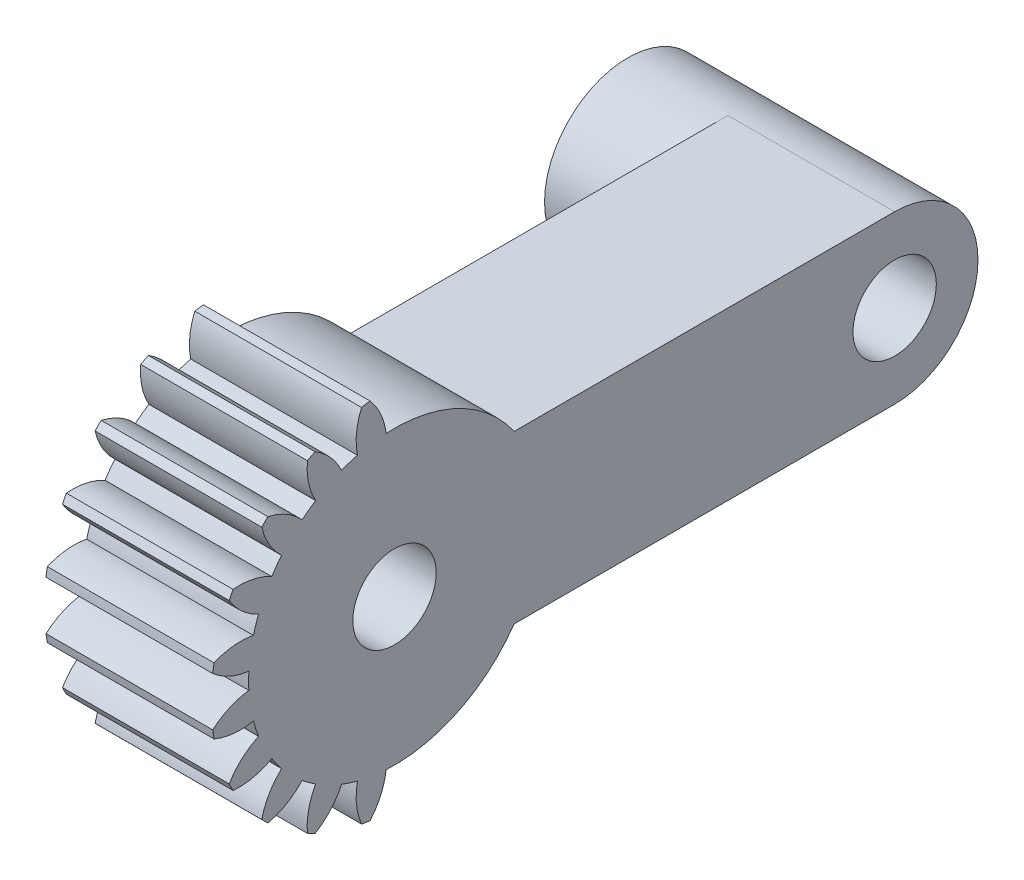
from build123d import *

# Parameters (mm, degrees)
SKETCH1_R           = 2.5
BOSS_EXTRUDE1_DEPTH = 10
SKETCH2_R           = 2.5
BOSS_EXTRUDE2_DEPTH = 10
SKETCH3_R           = 5
SKETCH3_R_2         = 2.5
BOSS_EXTRUDE3_DEPTH = 6
SKETCH4_R           = 2.5
CUT_EXTRUDE1_DEPTH  = 5
SKETCH6_R           = 1.5
CUT_EXTRUDE2_DEPTH  = 40.400672482
CUT_EXTRUDE3_START  = -3
SKETCH7_R           = 2.5
CUT_EXTRUDE3_DEPTH  = 3
SKETCH8_R           = 4.5
SKETCH8_R_2         = 2.5
BOSS_EXTRUDE4_DEPTH = 2
CUT_EXTRUDE4_DEPTH  = 42.078132772


with BuildPart() as part:
    # Sketch1 → Boss-Extrude1 (new body)
    with BuildSketch(Plane(origin=(4.043870029, 0, 0), x_dir=(0, 0, -1), z_dir=(1, 0, 0))):
        with BuildLine():
            ThreePointArc((-10.029541992, 0.342879069), (-9.019080639, -0.304016541), (-7.862233613, -0.622153359))
            ThreePointArc((-7.862233613, -0.622153359), (-7.876528296, -1.122077366), (-7.862233613, -1.622001374))
            ThreePointArc((-7.862233613, -1.622001374), (-9.019080639, -1.940138191), (-10.029541992, -2.587033801))
            ThreePointArc((-10.029541992, -2.587033801), (-9.992100042, -2.842856482), (-9.948655897, -3.097728508))
            ThreePointArc((-9.948655897, -3.097728508), (-8.787748306, -3.400713063), (-7.58921172, -3.345793765))
            ThreePointArc((-7.58921172, -3.345793765), (-7.448321757, -3.82566705), (-7.280241692, -4.296705735))
            ThreePointArc((-7.280241692, -4.296705735), (-8.282158911, -4.956757219), (-9.043263028, -5.884241235))
            ThreePointArc((-9.043263028, -5.884241235), (-8.928600062, -6.115972863), (-8.808522437, -6.344945585))
            ThreePointArc((-8.808522437, -6.344945585), (-7.610806331, -6.274360846), (-6.487901298, -5.851761317))
            ThreePointArc((-6.487901298, -5.851761317), (-6.20561798, -6.264610538), (-5.90020538, -6.660655353))
            ThreePointArc((-5.90020538, -6.660655353), (-6.649118154, -7.598011066), (-7.086362862, -8.715294889))
            ThreePointArc((-7.086362862, -8.715294889), (-6.905702889, -8.900251959), (-6.720745819, -9.080911932))
            ThreePointArc((-6.720745819, -9.080911932), (-5.603461996, -8.643667224), (-4.666106283, -7.89475445))
            ThreePointArc((-4.666106283, -7.89475445), (-4.270061468, -8.20016705), (-3.857212247, -8.482450368))
            ThreePointArc((-3.857212247, -8.482450368), (-4.279811776, -9.605355401), (-4.350396515, -10.803071507))
            ThreePointArc((-4.350396515, -10.803071507), (-4.121423793, -10.923149132), (-3.889692165, -11.037812099))
            ThreePointArc((-3.889692165, -11.037812099), (-2.962208149, -10.276707981), (-2.302156665, -9.274790762))
            ThreePointArc((-2.302156665, -9.274790762), (-1.83111798, -9.442870827), (-1.351244695, -9.583760791))
            ThreePointArc((-1.351244695, -9.583760791), (-1.406163992, -10.782297376), (-1.103179437, -11.943204968))
            ThreePointArc((-1.103179437, -11.943204968), (-0.848307411, -11.986649113), (-0.592484731, -12.024091063))
            ThreePointArc((-0.592484731, -12.024091063), (0.054410879, -11.01362971), (0.372547697, -9.856782684))
            ThreePointArc((0.372547697, -9.856782684), (0.872471704, -9.871077366), (1.372395712, -9.856782684))
            ThreePointArc((1.372395712, -9.856782684), (1.690532529, -11.01362971), (2.337428139, -12.024091063))
            ThreePointArc((2.337428139, -12.024091063), (2.59325082, -11.986649113), (2.848122846, -11.943204968))
            ThreePointArc((2.848122846, -11.943204968), (3.151107401, -10.782297376), (3.096188103, -9.583760791))
            ThreePointArc((3.096188103, -9.583760791), (3.576061388, -9.442870827), (4.047100073, -9.274790762))
            ThreePointArc((4.047100073, -9.274790762), (4.707151558, -10.276707981), (5.634635573, -11.037812099))
            ThreePointArc((5.634635573, -11.037812099), (5.866367201, -10.923149132), (6.095339923, -10.803071507))
            ThreePointArc((6.095339923, -10.803071507), (6.024755184, -9.605355401), (5.602155655, -8.482450368))
            ThreePointArc((5.602155655, -8.482450368), (6.015004877, -8.20016705), (6.411049691, -7.89475445))
            ThreePointArc((6.411049691, -7.89475445), (7.348405404, -8.643667224), (8.465689227, -9.080911932))
            ThreePointArc((8.465689227, -9.080911932), (8.650646297, -8.900251959), (8.83130627, -8.715294889))
            ThreePointArc((8.83130627, -8.715294889), (8.394061563, -7.598011066), (7.645148788, -6.660655353))
            ThreePointArc((7.645148788, -6.660655353), (7.950561388, -6.264610538), (8.232844706, -5.851761317))
            ThreePointArc((8.232844706, -5.851761317), (9.355749739, -6.274360846), (10.553465846, -6.344945585))
            ThreePointArc((10.553465846, -6.344945585), (10.67354347, -6.115972863), (10.788206437, -5.884241235))
            ThreePointArc((10.788206437, -5.884241235), (10.02710232, -4.956757219), (9.0251851, -4.296705735))
            ThreePointArc((9.0251851, -4.296705735), (9.193265165, -3.82566705), (9.334155129, -3.345793765))
            ThreePointArc((9.334155129, -3.345793765), (10.532691714, -3.400713063), (11.693599306, -3.097728508))
            ThreePointArc((11.693599306, -3.097728508), (11.737043451, -2.842856482), (11.774485401, -2.587033801))
            ThreePointArc((11.774485401, -2.587033801), (10.764024048, -1.940138191), (9.607177022, -1.622001374))
            ThreePointArc((9.607177022, -1.622001374), (9.621471704, -1.122077366), (9.607177022, -0.622153359))
            ThreePointArc((9.607177022, -0.622153359), (10.764024048, -0.304016541), (11.774485401, 0.342879069))
            ThreePointArc((11.774485401, 0.342879069), (11.737043451, 0.598701749), (11.693599306, 0.853573775))
            ThreePointArc((11.693599306, 0.853573775), (10.532691714, 1.156558331), (9.334155129, 1.101639033))
            ThreePointArc((9.334155129, 1.101639033), (9.193265165, 1.581512318), (9.0251851, 2.052551003))
            ThreePointArc((9.0251851, 2.052551003), (10.02710232, 2.712602487), (10.788206437, 3.640086503))
            ThreePointArc((10.788206437, 3.640086503), (10.67354347, 3.871818131), (10.553465846, 4.100790853))
            ThreePointArc((10.553465846, 4.100790853), (9.355749739, 4.030206114), (8.232844706, 3.607606585))
            ThreePointArc((8.232844706, 3.607606585), (7.950561388, 4.020455806), (7.645148788, 4.416500621))
            ThreePointArc((7.645148788, 4.416500621), (8.394061563, 5.353856334), (8.83130627, 6.471140157))
            ThreePointArc((8.83130627, 6.471140157), (8.650646297, 6.656097227), (8.465689227, 6.8367572))
            ThreePointArc((8.465689227, 6.8367572), (7.348405404, 6.399512492), (6.411049691, 5.650599718))
            ThreePointArc((6.411049691, 5.650599718), (6.015004877, 5.956012318), (5.602155655, 6.238295636))
            ThreePointArc((5.602155655, 6.238295636), (6.024755184, 7.361200669), (6.095339923, 8.558916775))
            ThreePointArc((6.095339923, 8.558916775), (5.866367201, 8.6789944), (5.634635573, 8.793657366))
            ThreePointArc((5.634635573, 8.793657366), (4.707151558, 8.032553249), (4.047100073, 7.03063603))
            ThreePointArc((4.047100073, 7.03063603), (3.576061388, 7.198716095), (3.096188103, 7.339606058))
            ThreePointArc((3.096188103, 7.339606058), (3.151107401, 8.538142644), (2.848122846, 9.699050235))
            ThreePointArc((2.848122846, 9.699050235), (2.59325082, 9.74249438), (2.337428139, 9.779936331))
            ThreePointArc((2.337428139, 9.779936331), (1.690532529, 8.769474978), (1.372395712, 7.612627952))
            ThreePointArc((1.372395712, 7.612627952), (0.872471704, 7.626922634), (0.372547697, 7.612627952))
            ThreePointArc((0.372547697, 7.612627952), (0.054410879, 8.769474978), (-0.592484731, 9.779936331))
            ThreePointArc((-0.592484731, 9.779936331), (-0.848307411, 9.74249438), (-1.103179437, 9.699050235))
            ThreePointArc((-1.103179437, 9.699050235), (-1.406163992, 8.538142644), (-1.351244695, 7.339606058))
            ThreePointArc((-1.351244695, 7.339606058), (-1.83111798, 7.198716095), (-2.302156665, 7.03063603))
            ThreePointArc((-2.302156665, 7.03063603), (-2.962208149, 8.032553249), (-3.889692165, 8.793657366))
            ThreePointArc((-3.889692165, 8.793657366), (-4.121423793, 8.6789944), (-4.350396515, 8.558916775))
            ThreePointArc((-4.350396515, 8.558916775), (-4.279811776, 7.361200669), (-3.857212247, 6.238295636))
            ThreePointArc((-3.857212247, 6.238295636), (-4.270061468, 5.956012318), (-4.666106283, 5.650599718))
            ThreePointArc((-4.666106283, 5.650599718), (-5.603461996, 6.399512492), (-6.720745819, 6.8367572))
            ThreePointArc((-6.720745819, 6.8367572), (-6.905702889, 6.656097227), (-7.086362862, 6.471140157))
            ThreePointArc((-7.086362862, 6.471140157), (-6.649118154, 5.353856334), (-5.90020538, 4.416500621))
            ThreePointArc((-5.90020538, 4.416500621), (-6.20561798, 4.020455806), (-6.487901298, 3.607606585))
            ThreePointArc((-6.487901298, 3.607606585), (-7.610806331, 4.030206114), (-8.808522437, 4.100790853))
            ThreePointArc((-8.808522437, 4.100790853), (-8.928600062, 3.871818131), (-9.043263028, 3.640086503))
            ThreePointArc((-9.043263028, 3.640086503), (-8.282158911, 2.712602487), (-7.280241692, 2.052551003))
            ThreePointArc((-7.280241692, 2.052551003), (-7.448321757, 1.581512318), (-7.58921172, 1.101639033))
            ThreePointArc((-7.58921172, 1.101639033), (-8.787748306, 1.156558331), (-9.948655897, 0.853573775))
            ThreePointArc((-9.948655897, 0.853573775), (-9.992100042, 0.598701749), (-10.029541992, 0.342879069))
        make_face()
        with Locations(Location((0.872471704, -1.122077366, 0), (0, 0, 180))):
            Circle(SKETCH1_R, mode=Mode.SUBTRACT)
    extrude(amount=-BOSS_EXTRUDE1_DEPTH)

    # Sketch2 → Boss-Extrude2 (add)
    with BuildSketch(Plane(origin=(4.043870029, 0, 0), x_dir=(0, 0, -1), z_dir=(1, 0, 0))):
        with BuildLine():
            Line((0.872471704, 3.877922634), (30.872471704, 3.877922634))
            ThreePointArc((30.872471704, 3.877922634), (35.872471704, -1.122077366), (30.872471704, -6.122077366))
            Line((30.872471704, -6.122077366), (0.872471704, -6.122077366))
            ThreePointArc((0.872471704, -6.122077366), (-4.127528296, -1.122077366), (0.872471704, 3.877922634))
        make_face()
        with Locations((30.872471704, -1.122077366)):
            Circle(SKETCH2_R, mode=Mode.SUBTRACT)
    extrude(amount=-BOSS_EXTRUDE2_DEPTH)

    # Sketch3 → Boss-Extrude3 (add)
    with BuildSketch(Plane.ZY.offset(5.956129971)):
        with Locations(Location((-30.872471704, -1.122077366, 0), (0, 0, 270))):
            Circle(SKETCH3_R)
        with Locations(Location((-30.872471704, -1.122077366, 0), (0, 0, 180))):
            Circle(SKETCH3_R_2, mode=Mode.SUBTRACT)
    extrude(amount=BOSS_EXTRUDE3_DEPTH)

    # Sketch4 → Cut-Extrude1 (cut)
    with BuildSketch(Plane(origin=(4.043870029, 0, 0), x_dir=(0, 0, -1), z_dir=(1, 0, 0))):
        with Locations((0.872471704, -1.122077366)):
            Circle(SKETCH4_R)
    extrude(amount=-CUT_EXTRUDE1_DEPTH, mode=Mode.SUBTRACT)

    # Sketch6 → Cut-Extrude2 (cut, through all)
    with BuildSketch(Plane(origin=(-0.956129971, 0, 0), x_dir=(0, 0, -1), z_dir=(1, 0, 0))):
        with Locations((0.872471704, -1.122077366)):
            Circle(SKETCH6_R)
    extrude(amount=-CUT_EXTRUDE2_DEPTH, mode=Mode.SUBTRACT)

    # Sketch7 → Cut-Extrude3 (cut)
    with BuildSketch(Plane.ZY.offset(5.956129971).offset(CUT_EXTRUDE3_START)):
        with Locations(Location((-0.872471704, -1.122077366, 0), (0, 0, 180))):
            Circle(SKETCH7_R)
    extrude(amount=CUT_EXTRUDE3_DEPTH, mode=Mode.SUBTRACT)

    # Sketch8 → Boss-Extrude4 (add)
    with BuildSketch(Plane.ZY.offset(5.956129971)):
        with Locations(Location((-0.872471704, -1.122077366, 0), (0, 0, 180))):
            Circle(SKETCH8_R)
        with Locations(Location((-0.872471704, -1.122077366, 0), (0, 0, 180))):
            Circle(SKETCH8_R_2, mode=Mode.SUBTRACT)
    extrude(amount=BOSS_EXTRUDE4_DEPTH)

    # Sketch9 → Cut-Extrude4 (cut, through all)
    with BuildSketch(Plane(origin=(4.043870029, 0, 0), x_dir=(0, 0, -1), z_dir=(1, 0, 0))):
        with BuildLine():
            Line((11.302349515, -6.122077366), (8.051956435, -6.122077366))
            ThreePointArc((8.051956435, -6.122077366), (4.922163112, -8.877398152), (0.872471704, -9.871077366))
            Line((0.872471704, -9.871077366), (0.872471704, -12.68850945))
            ThreePointArc((0.872471704, -12.68850945), (7.034865343, -10.910195458), (11.302349515, -6.122077366))
        make_face()
        with BuildLine():
            Line((11.302349515, 3.877922634), (8.051956435, 3.877922634))
            ThreePointArc((8.051956435, 3.877922634), (4.922163112, 6.63324342), (0.872471704, 7.626922634))
            Line((0.872471704, 7.626922634), (0.872471704, 10.444354718))
            ThreePointArc((0.872471704, 10.444354718), (7.034865343, 8.666040726), (11.302349515, 3.877922634))
        make_face()
    extrude(amount=-CUT_EXTRUDE4_DEPTH, mode=Mode.SUBTRACT)


solid = part.part
